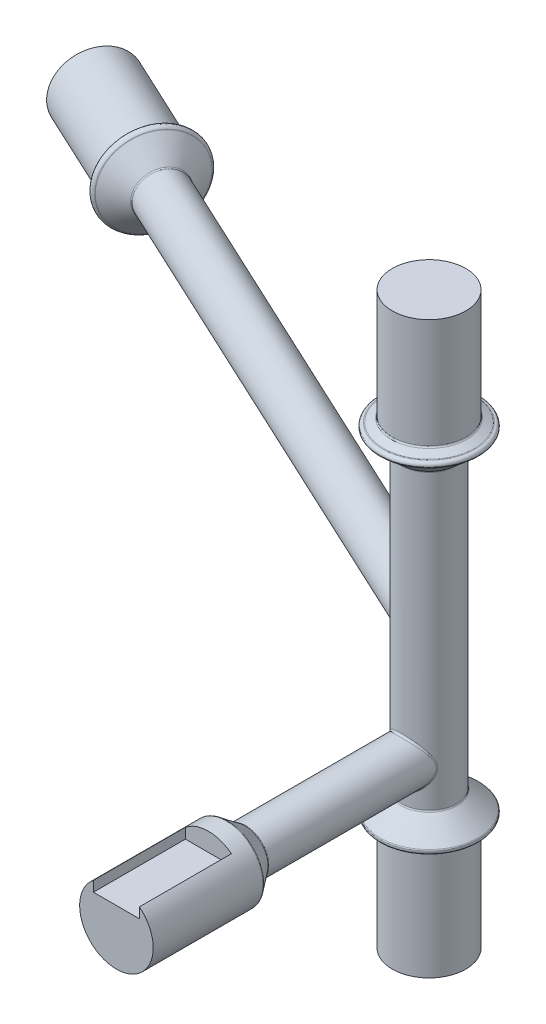
from build123d import *

# Parameters (mm, degrees)
SKETCH5_R           = 2.5
BOSS_EXTRUDE3_DEPTH = 20
SKETCH7_R           = 4
BOSS_EXTRUDE4_DEPTH = 14
SKETCH9_W           = 5
SKETCH9_H           = 10
CUT_EXTRUDE1_DEPTH  = 2
FILLET1_R           = 0.2


with BuildPart() as part:
    # Sketch3 → Revolve3 (revolve)
    with BuildSketch(Plane.XY, mode=Mode.PRIVATE) as revolve3_sk:
        with BuildLine():
            Line((4, 31), (0, 31))
            Line((0, 31), (0, 0))
            Line((0, 0), (3, 0))
            Line((3, 0), (3, 16))
            Line((3, 16), (5.365276993, 18))
            ThreePointArc((5.365276993, 18), (5.335582796, 18.361734067), (5, 18.5))
            Line((5, 18.5), (4, 19))
            Line((4, 19), (4, 31))
        make_face()
        with BuildLine():
            Line((3, 0), (0, 0))
            Line((0, 0), (0, -31))
            Line((0, -31), (4, -31))
            Line((4, -31), (4, -19))
            Line((4, -19), (5, -18.5))
            ThreePointArc((5, -18.5), (5.335582796, -18.361734067), (5.365276993, -18))
            Line((5.365276993, -18), (3, -16))
            Line((3, -16), (3, 0))
        make_face()
    revolve(revolve3_sk.sketch.rotate(Axis((0, 31, 0), (0, -1, 0)), 180), axis=Axis((0, 31, 0), (0, -1, 0)))

    # Sketch5 → Boss-Extrude3 (add)
    with BuildSketch(Plane.XY):
        with Locations(Location((0, -12, 0), (0, 0, 180))):
            Circle(SKETCH5_R)
    extrude(amount=BOSS_EXTRUDE3_DEPTH)

    # Sketch7 → Boss-Extrude4 (add)
    with BuildSketch(Plane.XY.offset(20)):
        with Locations((0, -12)):
            Circle(SKETCH7_R)
    extrude(amount=BOSS_EXTRUDE4_DEPTH)

    # Sketch8 → Cut-Revolve1 (revolve, cut)
    with BuildSketch(Plane(origin=(0, 0, 0), x_dir=(0, 0, -1), z_dir=(1, 0, 0)), mode=Mode.PRIVATE) as cut_revolve1_sk:
        Polygon((-20, -9.5), (-22, -8), (-20, -8), align=None)
    revolve(cut_revolve1_sk.sketch.rotate(Axis((0, -12, 34), (0, 0, -1)), 90), axis=Axis((0, -12, 34), (0, 0, -1)), mode=Mode.SUBTRACT)

    # Sketch9 → Cut-Extrude1 (cut)
    with BuildSketch(Plane(origin=(0, -8, 0), x_dir=(1, 0, 0), z_dir=(0, 1, 0))):
        with Locations((0, -29)):
            Rectangle(SKETCH9_W, SKETCH9_H)
    extrude(amount=-CUT_EXTRUDE1_DEPTH, mode=Mode.SUBTRACT)

    # Sketch10 → Revolve4 (revolve)
    with BuildSketch(Plane(origin=(0, 0, 0), x_dir=(1, 0, 0), z_dir=(0, 1, 0)), mode=Mode.PRIVATE) as revolve4_sk:
        with BuildLine():
            Line((-67.973084028, 31.696369631), (-54.378467222, 25.357095704))
            Line((-54.378467222, 25.357095704), (0, 0))
            Line((0, 0), (-1.056545654, -2.265769468))
            Line((-1.056545654, -2.265769468), (-55.435012877, 23.091326237))
            Line((-55.435012877, 23.091326237), (-58.165012877, 21.831045364))
            ThreePointArc((-58.165012877, 21.831045364), (-58.544470874, 21.750496661), (-58.840562054, 22.001108869))
            Line((-58.840562054, 22.001108869), (-58.78786363, 22.999719342))
            Line((-58.78786363, 22.999719342), (-69.663557075, 28.071138482))
            Line((-69.663557075, 28.071138482), (-67.973084028, 31.696369631))
        make_face()
    revolve(revolve4_sk.sketch.rotate(Axis((0, 0, 0), (-0.906307787036651, 0, -0.42261826174069705)), 180), axis=Axis((0, 0, 0), (-0.906307787036651, 0, -0.42261826174069705)))

    # Fillet1
    fillet1_edges = [part.edges().sort_by_distance(p)[0] for p in [
        (4, 19, 0),
        (5, 18.5, 0),
        (5.365276993, 18, 0),
        (3, 16, 0),
        (3, -16, 0),
        (5.365276993, -18, 0),
        (5, -18.5, 0),
        (4, -19, 0),
        (2.5, -12, 1.658312395),
        (0, -14.5, 20),
        (-4, -12, 22),
        (-1.896784039, 2.132434472, -2.324265526),
        (-58.840562054, 0, -22.001108869),
        (-58.78786363, 0, -22.999719342),
        (-55.435012877, 0, -23.091326237),
        (-58.165012877, 0, -21.831045364),
    ]]
    fillet(fillet1_edges, radius=FILLET1_R)


solid = part.part
